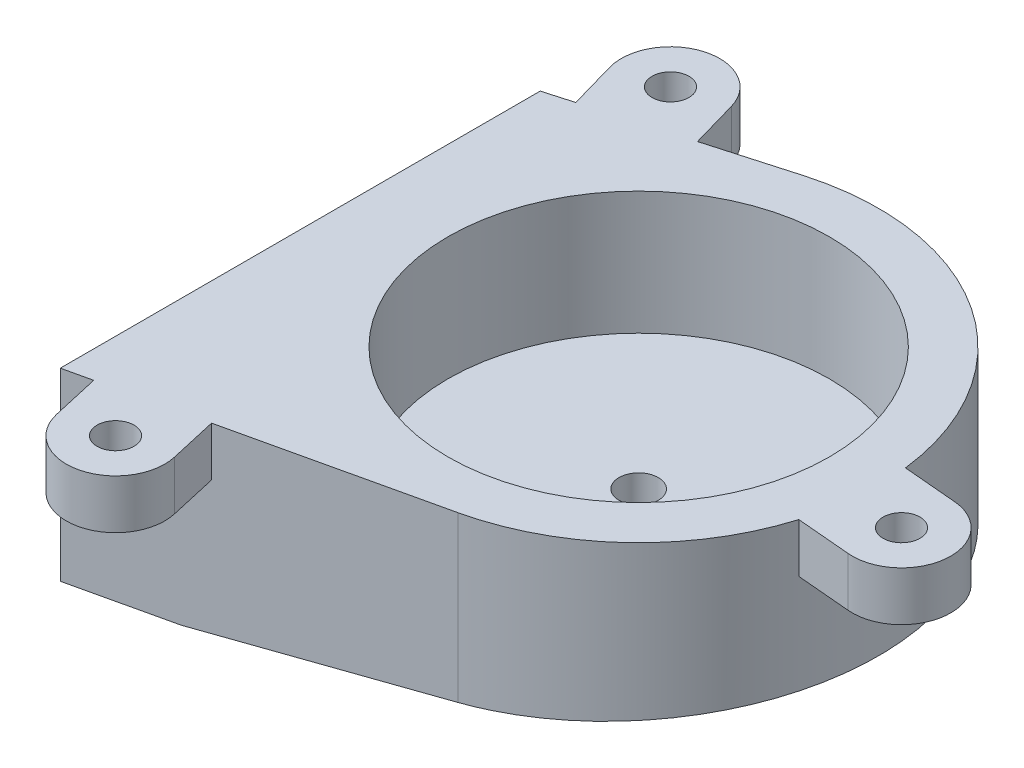
from build123d import *

# Parameters (mm, degrees)
SKETCH1_R               = 15.5
BOSS_EXTRUDE1_DEPTH     = 5
SKETCH2_R               = 15.5
BOSS_EXTRUDE2_DEPTH     = 15
CUT_EXTRUDE7_DEPTH      = 37.523964735
CUT_EXTRUDE7_DEPTH_BACK = 37.523964735
SKETCH18_R              = 1.6
CUT_EXTRUDE8_DEPTH      = 35.770677301
SKETCH19_R              = 2.05
CUT_EXTRUDE9_DEPTH      = 6
CUT_EXTRUDE10_REACH     = 37.749
SKETCH20_R              = 4
BOSS_EXTRUDE3_START     = -4
SKETCH21_R              = 1.5
SKETCH21_R_2            = 4
BOSS_EXTRUDE3_DEPTH     = 4


with BuildPart() as part:
    # Sketch1 → Boss-Extrude1 (new body)
    with BuildSketch(Plane(origin=(0, 0, 0), x_dir=(1, 0, 0), z_dir=(0, 1, 0))):
        with Locations(Location((0, 0, 0), (0, 0, 270))):
            Circle(SKETCH1_R)
    extrude(amount=BOSS_EXTRUDE1_DEPTH)

    # Sketch2 → Boss-Extrude2 (add)
    with BuildSketch(Plane.XZ):
        with BuildLine():
            Line((-22, -14), (-5.351429285, -18.751325409))
            ThreePointArc((-5.351429285, -18.751325409), (18.889988887, -4.839247858), (4.323483194, 19.014665211))
            Line((4.323483194, 19.014665211), (-22, 25))
            Line((-22, 25), (-22, -14))
        make_face()
        with Locations(Location((0, 0, 0), (0, 0, 270))):
            Circle(SKETCH2_R, mode=Mode.SUBTRACT)
    extrude(amount=-BOSS_EXTRUDE2_DEPTH)

    # Sketch17 → Cut-Extrude7 (cut, two sides: drawn at the far end of the back side and taken through both)
    with BuildSketch(Plane.XY.offset(-CUT_EXTRUDE7_DEPTH_BACK)):
        Polygon((19.5, 0), (-14, 0), (19.5, 3), align=None)
    extrude(amount=CUT_EXTRUDE7_DEPTH + CUT_EXTRUDE7_DEPTH_BACK, mode=Mode.SUBTRACT)

    # Sketch18 → Cut-Extrude8 (cut, through all)
    with BuildSketch(Plane(origin=(0, 5, 0), x_dir=(1, 0, 0), z_dir=(0, 1, 0))):
        with Locations(Location((0, 0, 0), (0, 0, 270))):
            Circle(SKETCH18_R)
    extrude(amount=-CUT_EXTRUDE8_DEPTH, mode=Mode.SUBTRACT)

    # Sketch19 → Cut-Extrude9 (cut)
    with BuildSketch(Plane.XZ):
        with Locations(Location((-18, 5.5, 0), (0, 0, 270))):
            Circle(SKETCH19_R)
    extrude(amount=-CUT_EXTRUDE9_DEPTH, mode=Mode.SUBTRACT)

    # Cut-Extrude10: up to this plane
    cut_extrude10_end = Plane(origin=(-0.111381215, 1.243756906, -23.586652897), z_dir=(0.08919529754965994, -0.996014155971203, 0))
    # Sketch20 → Cut-Extrude10 (cut, up to the surface)
    with BuildSketch(Plane(origin=(0, 2, 0), x_dir=(1, 0, 0), z_dir=(0, 1, 0)), mode=Mode.PRIVATE) as cut_extrude10_sk1:
        with Locations(Location((0, 0, 0), (0, 0, 270))):
            Circle(SKETCH20_R)
    cut_extrude10_tool1 = split(extrude(cut_extrude10_sk1.sketch, amount=-CUT_EXTRUDE10_REACH, mode=Mode.PRIVATE), bisect_by=cut_extrude10_end, keep=Keep.BOTH, mode=Mode.PRIVATE)
    add(cut_extrude10_tool1.solids().sort_by_distance((0, 2, 0))[0], mode=Mode.SUBTRACT)

    # Sketch21 → Boss-Extrude3 (add)
    # profile 1 of 5: a face of its own
    with BuildSketch(Plane(origin=(0, 15, 0), x_dir=(1, 0, 0), z_dir=(0, 1, 0)).offset(BOSS_EXTRUDE3_START)):
        with BuildLine():
            ThreePointArc((-13.153574275, 20.684381981), (-18.097729084, 23.433078622), (-20.846425725, 18.488923813))
            Line((-20.846425725, 18.488923813), (-19.748696641, 14.642498088))
            Line((-19.748696641, 14.642498088), (-12.055845191, 16.837956256))
            Line((-12.055845191, 16.837956256), (-13.153574275, 20.684381981))
        make_face()
        with Locations(Location((-17, 19.586652897, 0), (0, 0, 270))):
            Circle(SKETCH21_R, mode=Mode.SUBTRACT)
    # profile 2 of 5: a face of its own
    with BuildSketch(Plane(origin=(0, 15, 0), x_dir=(1, 0, 0), z_dir=(0, 1, 0)).offset(BOSS_EXTRUDE3_START)):
        with BuildLine():
            Line((-11.099555854, -26.623594872), (-11.986424202, -22.723150726))
            Line((-11.986424202, -22.723150726), (-19.787312493, -24.496887421))
            Line((-19.787312493, -24.496887421), (-18.900444146, -28.397331567))
            ThreePointArc((-18.900444146, -28.397331567), (-14.113131653, -31.410907365), (-11.099555854, -26.623594872))
        make_face()
        with Locations(Location((-15, -27.51046322, 0), (0, 0, 270))):
            Circle(SKETCH21_R, mode=Mode.SUBTRACT)
    # profile 3 of 5: a face of its own
    with BuildSketch(Plane(origin=(0, 15, 0), x_dir=(1, 0, 0), z_dir=(0, 1, 0)).offset(BOSS_EXTRUDE3_START)):
        with BuildLine():
            ThreePointArc((23.061952434, -6.032938747), (20.346397625, -4.619310384), (19.425796615, -1.699536959))
            ThreePointArc((19.425796615, -1.699536959), (19.147003171, -3.69354431), (18.664086253, -5.648175312))
            Line((18.664086253, -5.648175312), (23.061952434, -6.032938747))
        make_face()
    # profile 4 of 5: a face of its own
    with BuildSketch(Plane(origin=(0, 15, 0), x_dir=(1, 0, 0), z_dir=(0, 1, 0)).offset(BOSS_EXTRUDE3_START)):
        with Locations((23.410575405, -2.048159955)):
            Circle(SKETCH21_R_2)
        with Locations(Location((23.410575405, -2.048159955, 0), (0, 0, 270))):
            Circle(SKETCH21_R, mode=Mode.SUBTRACT)
    # profile 5 of 5: a face of its own
    with BuildSketch(Plane(origin=(0, 15, 0), x_dir=(1, 0, 0), z_dir=(0, 1, 0)).offset(BOSS_EXTRUDE3_START)):
        with BuildLine():
            Line((23.759198376, 1.936618838), (19.361332194, 2.321382272))
            ThreePointArc((19.361332194, 2.321382272), (19.497494408, 0.31258889), (19.425796615, -1.699536959))
            ThreePointArc((19.425796615, -1.699536959), (20.839424976, 1.016017826), (23.759198376, 1.936618838))
        make_face()
    extrude(amount=BOSS_EXTRUDE3_DEPTH)


solid = part.part
